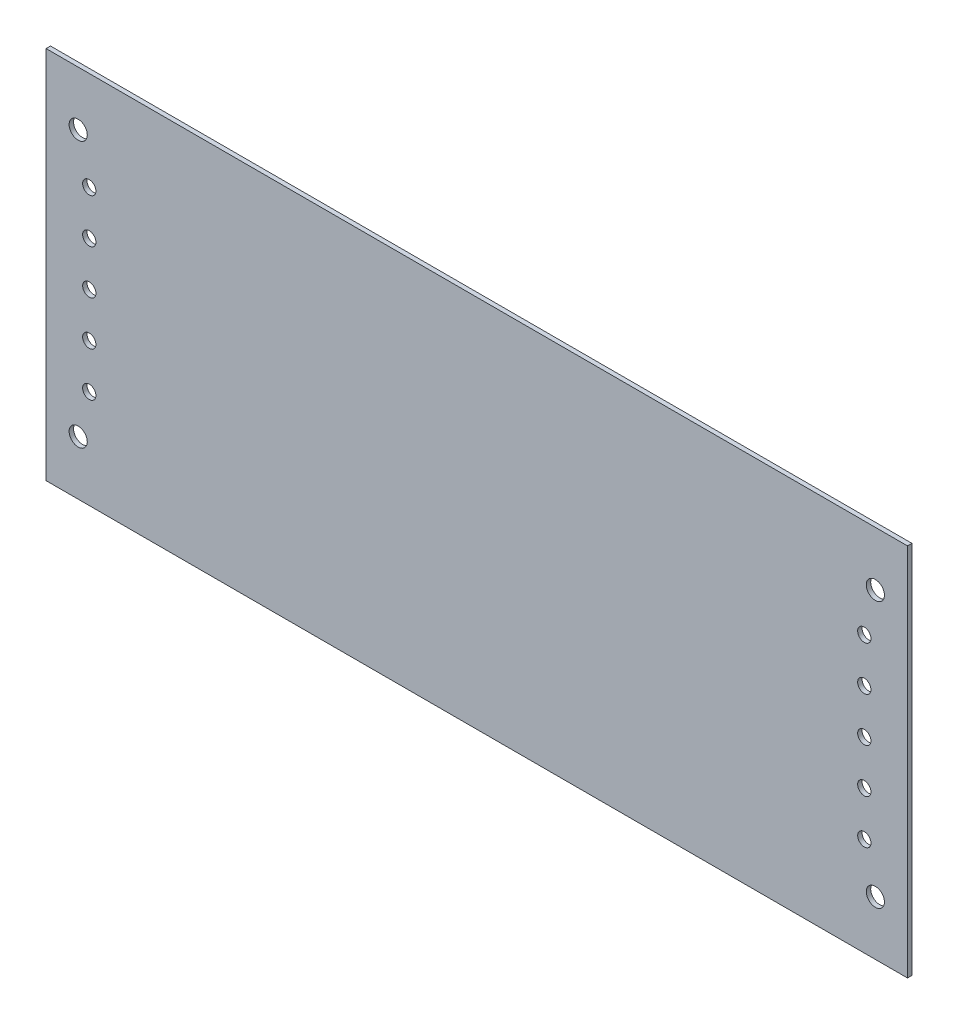
from build123d import *

# Parameters (mm, degrees)
MODEL_W             = 389
MODEL_H             = 169
BOSS_EXTRUDE1_DEPTH = 2
SKETCH1_R           = 3
SKETCH1_R_2         = 4.1
CUT_EXTRUDE1_DEPTH  = 213.071921762


with BuildPart() as part:
    # Model → Boss-Extrude1 (new body)
    with BuildSketch(Plane.XY):
        Rectangle(MODEL_W, MODEL_H)
    extrude(amount=BOSS_EXTRUDE1_DEPTH)

    # Sketch1 → Cut-Extrude1 (cut, through all)
    with BuildSketch(Plane.XY.offset(2)):
        with Locations((-175, 0)):
            Circle(SKETCH1_R)
        with Locations((175, 0)):
            Circle(SKETCH1_R)
        with Locations((-175, 20)):
            Circle(SKETCH1_R)
        with Locations((175, 20)):
            Circle(SKETCH1_R)
        with Locations((-175, 40)):
            Circle(SKETCH1_R)
        with Locations((175, 40)):
            Circle(SKETCH1_R)
        with Locations((-180, 60)):
            Circle(SKETCH1_R_2)
        with Locations((180, 60)):
            Circle(SKETCH1_R_2)
        with Locations((-175, -20)):
            Circle(SKETCH1_R)
        with Locations((175, -20)):
            Circle(SKETCH1_R)
        with Locations((-175, -40)):
            Circle(SKETCH1_R)
        with Locations((175, -40)):
            Circle(SKETCH1_R)
        with Locations((-180, -60)):
            Circle(SKETCH1_R_2)
        with Locations((180, -60)):
            Circle(SKETCH1_R_2)
    extrude(amount=-CUT_EXTRUDE1_DEPTH, mode=Mode.SUBTRACT)


solid = part.part
